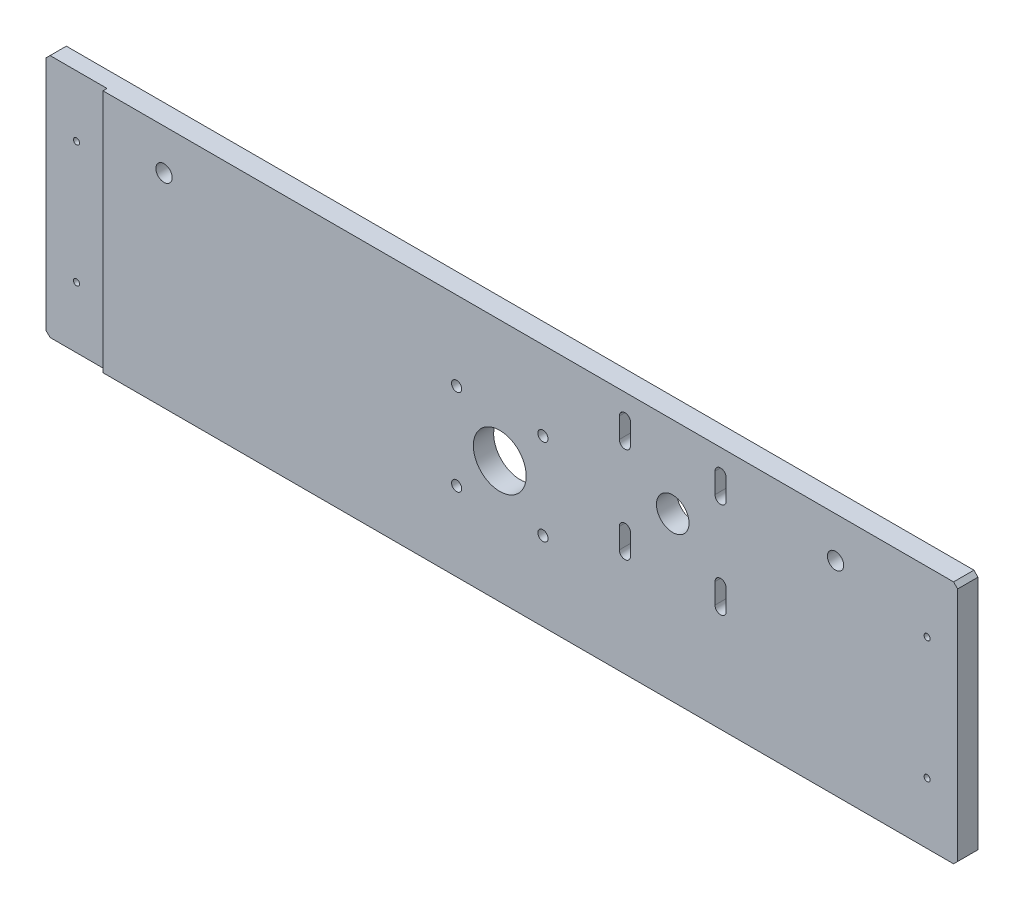
from build123d import *

# Parameters (mm, degrees)
SCHIZZO1_R                   = 13
SCHIZZO1_R_2                 = 2.5
SCHIZZO1_R_3                 = 4
SCHIZZO1_R_4                 = 1.5
SCHIZZO1_R_5                 = 8
ESTRUSIONE_ESTRUSIONE1_DEPTH = 10
SCHIZZO2_W                   = 30
SCHIZZO2_H                   = 120
TAGLIO_ESTRUSIONE1_DEPTH     = 2


with BuildPart() as part:
    # Schizzo1 → Estrusione-Estrusione1 (new body)
    with BuildSketch(Plane.XY):
        Polygon((2, 0), (448, 0), (450, 2), (450, 118), (448, 120), (2, 120), (0, 118), (0, 2), align=None)
        with Locations((225, 60)):
            Circle(SCHIZZO1_R, mode=Mode.SUBTRACT)
        with Locations(Location((246.213203436, 81.213203436, 0), (0, 0, 180))):
            Circle(SCHIZZO1_R_2, mode=Mode.SUBTRACT)
        with Locations((390, 100)):
            Circle(SCHIZZO1_R_3, mode=Mode.SUBTRACT)
        with Locations((246.213203436, 38.786796564)):
            Circle(SCHIZZO1_R_2, mode=Mode.SUBTRACT)
        with Locations(Location((203.786796564, 38.786796564, 0), (0, 0, 180))):
            Circle(SCHIZZO1_R_2, mode=Mode.SUBTRACT)
        with Locations(Location((60, 100, 0), (0, 0, 180))):
            Circle(SCHIZZO1_R_3, mode=Mode.SUBTRACT)
        with Locations((15, 30)):
            Circle(SCHIZZO1_R_4, mode=Mode.SUBTRACT)
        with Locations(Location((435, 30, 0), (0, 0, 180))):
            Circle(SCHIZZO1_R_4, mode=Mode.SUBTRACT)
        with Locations((203.786796564, 81.213203436)):
            Circle(SCHIZZO1_R_2, mode=Mode.SUBTRACT)
        with Locations((435, 90)):
            Circle(SCHIZZO1_R_4, mode=Mode.SUBTRACT)
        with Locations(Location((15, 90, 0), (0, 0, 180))):
            Circle(SCHIZZO1_R_4, mode=Mode.SUBTRACT)
        with Locations((310, 80)):
            Circle(SCHIZZO1_R_5, mode=Mode.SUBTRACT)
        with BuildLine():
            Line((330.75, 108.5), (330.75, 98.5))
            ThreePointArc((330.75, 98.5), (333.5, 95.75), (336.25, 98.5))
            Line((336.25, 98.5), (336.25, 108.5))
            ThreePointArc((336.25, 108.5), (333.5, 111.25), (330.75, 108.5))
        make_face(mode=Mode.SUBTRACT)
        with BuildLine():
            Line((289.25, 108.5), (289.25, 98.5))
            ThreePointArc((289.25, 98.5), (286.5, 95.75), (283.75, 98.5))
            Line((283.75, 98.5), (283.75, 108.5))
            ThreePointArc((283.75, 108.5), (286.5, 111.25), (289.25, 108.5))
        make_face(mode=Mode.SUBTRACT)
        with BuildLine():
            Line((330.75, 51.5), (330.75, 61.5))
            ThreePointArc((330.75, 61.5), (333.5, 64.25), (336.25, 61.5))
            Line((336.25, 61.5), (336.25, 51.5))
            ThreePointArc((336.25, 51.5), (333.5, 48.75), (330.75, 51.5))
        make_face(mode=Mode.SUBTRACT)
        with BuildLine():
            Line((289.25, 51.5), (289.25, 61.5))
            ThreePointArc((289.25, 61.5), (286.5, 64.25), (283.75, 61.5))
            Line((283.75, 61.5), (283.75, 51.5))
            ThreePointArc((283.75, 51.5), (286.5, 48.75), (289.25, 51.5))
        make_face(mode=Mode.SUBTRACT)
    extrude(amount=-ESTRUSIONE_ESTRUSIONE1_DEPTH)

    # Schizzo2 → Taglio-Estrusione1 (cut)
    with BuildSketch(Plane.XY):
        with Locations((15, 60)):
            Rectangle(SCHIZZO2_W, SCHIZZO2_H)
        with Locations((615.438855383, 60)):
            Rectangle(SCHIZZO2_W, SCHIZZO2_H)
    extrude(amount=-TAGLIO_ESTRUSIONE1_DEPTH, mode=Mode.SUBTRACT)


solid = part.part
